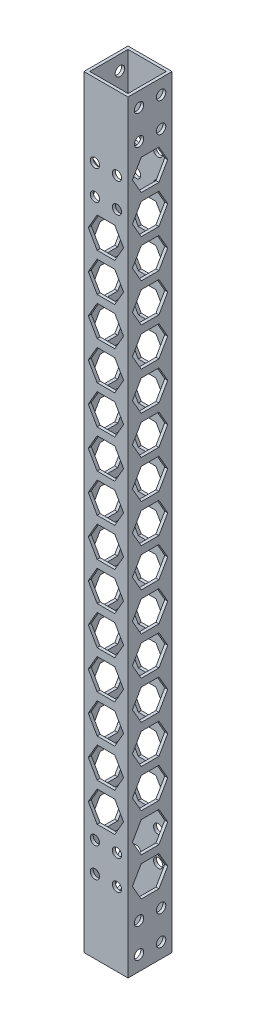
from build123d import *

# Parameters (mm, degrees)
SKETCH_1_W          = 15
SKETCH_1_H          = 15
SKETCH_1_W_2        = 13
SKETCH_1_H_2        = 13
EXTRUDE_1_DEPTH     = 259.4
CUT_EXTRUDE_1_REACH = 261.942
SKETCH_2_R          = 1.575
SKETCH_3_R          = 1.6
CUT_EXTRUDE_2_DEPTH = 15


with BuildPart() as part:
    # 草图1 → 凸台-拉伸1 (new body)
    with BuildSketch(Plane(origin=(0, 0, 0), x_dir=(1, 0, 0), z_dir=(0, 1, 0))):
        Rectangle(SKETCH_1_W, SKETCH_1_H)
        Rectangle(SKETCH_1_W_2, SKETCH_1_H_2, mode=Mode.SUBTRACT)
    extrude(amount=EXTRUDE_1_DEPTH)

    # 切除-拉伸1: up to this face of the body (flat: up to its plane)
    cut_extrude_1_end = Plane(part.part.faces().sort_by_distance((0, 129.7, -7.5))[0])
    # 草图2 → 切除-拉伸1 (cut, up to the picked face)
    with BuildSketch(Plane.XY.offset(7.5), mode=Mode.PRIVATE) as cut_extrude_1_sk1:
        with Locations((-3.75, 234.4)):
            Circle(SKETCH_2_R)
    cut_extrude_1_tool1 = split(extrude(cut_extrude_1_sk1.sketch, amount=-CUT_EXTRUDE_1_REACH, mode=Mode.PRIVATE), bisect_by=cut_extrude_1_end, keep=Keep.BOTH, mode=Mode.PRIVATE)
    # 草图2 → 切除-拉伸1 (cut, up to the picked face)
    with BuildSketch(Plane.XY.offset(7.5), mode=Mode.PRIVATE) as cut_extrude_1_sk2:
        with Locations((3.75, 234.4)):
            Circle(SKETCH_2_R)
    cut_extrude_1_tool2 = split(extrude(cut_extrude_1_sk2.sketch, amount=-CUT_EXTRUDE_1_REACH, mode=Mode.PRIVATE), bisect_by=cut_extrude_1_end, keep=Keep.BOTH, mode=Mode.PRIVATE)
    # 草图2 → 切除-拉伸1 (cut, up to the picked face)
    with BuildSketch(Plane.XY.offset(7.5), mode=Mode.PRIVATE) as cut_extrude_1_sk3:
        with Locations((-3.75, 224.4)):
            Circle(SKETCH_2_R)
    cut_extrude_1_tool3 = split(extrude(cut_extrude_1_sk3.sketch, amount=-CUT_EXTRUDE_1_REACH, mode=Mode.PRIVATE), bisect_by=cut_extrude_1_end, keep=Keep.BOTH, mode=Mode.PRIVATE)
    # 草图2 → 切除-拉伸1 (cut, up to the picked face)
    with BuildSketch(Plane.XY.offset(7.5), mode=Mode.PRIVATE) as cut_extrude_1_sk4:
        with Locations((3.75, 224.4)):
            Circle(SKETCH_2_R)
    cut_extrude_1_tool4 = split(extrude(cut_extrude_1_sk4.sketch, amount=-CUT_EXTRUDE_1_REACH, mode=Mode.PRIVATE), bisect_by=cut_extrude_1_end, keep=Keep.BOTH, mode=Mode.PRIVATE)
    # 草图2 → 切除-拉伸1 (cut, up to the picked face)
    with BuildSketch(Plane.XY.offset(7.5), mode=Mode.PRIVATE) as cut_extrude_1_sk5:
        with Locations((3.75, 35)):
            Circle(SKETCH_2_R)
    cut_extrude_1_tool5 = split(extrude(cut_extrude_1_sk5.sketch, amount=-CUT_EXTRUDE_1_REACH, mode=Mode.PRIVATE), bisect_by=cut_extrude_1_end, keep=Keep.BOTH, mode=Mode.PRIVATE)
    # 草图2 → 切除-拉伸1 (cut, up to the picked face)
    with BuildSketch(Plane.XY.offset(7.5), mode=Mode.PRIVATE) as cut_extrude_1_sk6:
        with Locations((-3.75, 35)):
            Circle(SKETCH_2_R)
    cut_extrude_1_tool6 = split(extrude(cut_extrude_1_sk6.sketch, amount=-CUT_EXTRUDE_1_REACH, mode=Mode.PRIVATE), bisect_by=cut_extrude_1_end, keep=Keep.BOTH, mode=Mode.PRIVATE)
    # 草图2 → 切除-拉伸1 (cut, up to the picked face)
    with BuildSketch(Plane.XY.offset(7.5), mode=Mode.PRIVATE) as cut_extrude_1_sk7:
        with Locations((3.75, 25)):
            Circle(SKETCH_2_R)
    cut_extrude_1_tool7 = split(extrude(cut_extrude_1_sk7.sketch, amount=-CUT_EXTRUDE_1_REACH, mode=Mode.PRIVATE), bisect_by=cut_extrude_1_end, keep=Keep.BOTH, mode=Mode.PRIVATE)
    # 草图2 → 切除-拉伸1 (cut, up to the picked face)
    with BuildSketch(Plane.XY.offset(7.5), mode=Mode.PRIVATE) as cut_extrude_1_sk8:
        with Locations((-3.75, 25)):
            Circle(SKETCH_2_R)
    cut_extrude_1_tool8 = split(extrude(cut_extrude_1_sk8.sketch, amount=-CUT_EXTRUDE_1_REACH, mode=Mode.PRIVATE), bisect_by=cut_extrude_1_end, keep=Keep.BOTH, mode=Mode.PRIVATE)
    # 草图2 → 切除-拉伸1 (cut, up to the picked face)
    with BuildSketch(Plane.XY.offset(7.5), mode=Mode.PRIVATE) as cut_extrude_1_sk9:
        Polygon((3, 206.4), (-3, 206.4), (-6, 201.203847577), (-3, 196.007695155), (3, 196.007695155), (6, 201.203847577), align=None)
    cut_extrude_1_tool9 = split(extrude(cut_extrude_1_sk9.sketch, amount=-CUT_EXTRUDE_1_REACH, mode=Mode.PRIVATE), bisect_by=cut_extrude_1_end, keep=Keep.BOTH, mode=Mode.PRIVATE)
    # 草图2 → 切除-拉伸1 (cut, up to the picked face)
    with BuildSketch(Plane.XY.offset(7.5), mode=Mode.PRIVATE) as cut_extrude_1_sk10:
        Polygon((-3, 219.4), (-6, 214.203847577), (-3, 209.007695155), (3, 209.007695155), (6, 214.203847577), (3, 219.4), align=None)
    cut_extrude_1_tool10 = split(extrude(cut_extrude_1_sk10.sketch, amount=-CUT_EXTRUDE_1_REACH, mode=Mode.PRIVATE), bisect_by=cut_extrude_1_end, keep=Keep.BOTH, mode=Mode.PRIVATE)
    # 草图2 → 切除-拉伸1 (cut, up to the picked face)
    with BuildSketch(Plane.XY.offset(7.5), mode=Mode.PRIVATE) as cut_extrude_1_sk11:
        Polygon((3, 193.4), (-3, 193.4), (-6, 188.203847577), (-3, 183.007695155), (3, 183.007695155), (6, 188.203847577), align=None)
    cut_extrude_1_tool11 = split(extrude(cut_extrude_1_sk11.sketch, amount=-CUT_EXTRUDE_1_REACH, mode=Mode.PRIVATE), bisect_by=cut_extrude_1_end, keep=Keep.BOTH, mode=Mode.PRIVATE)
    # 草图2 → 切除-拉伸1 (cut, up to the picked face)
    with BuildSketch(Plane.XY.offset(7.5), mode=Mode.PRIVATE) as cut_extrude_1_sk12:
        Polygon((3, 180.4), (-3, 180.4), (-6, 175.203847577), (-3, 170.007695155), (3, 170.007695155), (6, 175.203847577), align=None)
    cut_extrude_1_tool12 = split(extrude(cut_extrude_1_sk12.sketch, amount=-CUT_EXTRUDE_1_REACH, mode=Mode.PRIVATE), bisect_by=cut_extrude_1_end, keep=Keep.BOTH, mode=Mode.PRIVATE)
    # 草图2 → 切除-拉伸1 (cut, up to the picked face)
    with BuildSketch(Plane.XY.offset(7.5), mode=Mode.PRIVATE) as cut_extrude_1_sk13:
        Polygon((3, 167.4), (-3, 167.4), (-6, 162.203847577), (-3, 157.007695155), (3, 157.007695155), (6, 162.203847577), align=None)
    cut_extrude_1_tool13 = split(extrude(cut_extrude_1_sk13.sketch, amount=-CUT_EXTRUDE_1_REACH, mode=Mode.PRIVATE), bisect_by=cut_extrude_1_end, keep=Keep.BOTH, mode=Mode.PRIVATE)
    # 草图2 → 切除-拉伸1 (cut, up to the picked face)
    with BuildSketch(Plane.XY.offset(7.5), mode=Mode.PRIVATE) as cut_extrude_1_sk14:
        Polygon((3, 154.4), (-3, 154.4), (-6, 149.203847577), (-3, 144.007695155), (3, 144.007695155), (6, 149.203847577), align=None)
    cut_extrude_1_tool14 = split(extrude(cut_extrude_1_sk14.sketch, amount=-CUT_EXTRUDE_1_REACH, mode=Mode.PRIVATE), bisect_by=cut_extrude_1_end, keep=Keep.BOTH, mode=Mode.PRIVATE)
    # 草图2 → 切除-拉伸1 (cut, up to the picked face)
    with BuildSketch(Plane.XY.offset(7.5), mode=Mode.PRIVATE) as cut_extrude_1_sk15:
        Polygon((3, 141.4), (-3, 141.4), (-6, 136.203847577), (-3, 131.007695155), (3, 131.007695155), (6, 136.203847577), align=None)
    cut_extrude_1_tool15 = split(extrude(cut_extrude_1_sk15.sketch, amount=-CUT_EXTRUDE_1_REACH, mode=Mode.PRIVATE), bisect_by=cut_extrude_1_end, keep=Keep.BOTH, mode=Mode.PRIVATE)
    # 草图2 → 切除-拉伸1 (cut, up to the picked face)
    with BuildSketch(Plane.XY.offset(7.5), mode=Mode.PRIVATE) as cut_extrude_1_sk16:
        Polygon((3, 128.4), (-3, 128.4), (-6, 123.203847577), (-3, 118.007695155), (3, 118.007695155), (6, 123.203847577), align=None)
    cut_extrude_1_tool16 = split(extrude(cut_extrude_1_sk16.sketch, amount=-CUT_EXTRUDE_1_REACH, mode=Mode.PRIVATE), bisect_by=cut_extrude_1_end, keep=Keep.BOTH, mode=Mode.PRIVATE)
    # 草图2 → 切除-拉伸1 (cut, up to the picked face)
    with BuildSketch(Plane.XY.offset(7.5), mode=Mode.PRIVATE) as cut_extrude_1_sk17:
        Polygon((3, 115.4), (-3, 115.4), (-6, 110.203847577), (-3, 105.007695155), (3, 105.007695155), (6, 110.203847577), align=None)
    cut_extrude_1_tool17 = split(extrude(cut_extrude_1_sk17.sketch, amount=-CUT_EXTRUDE_1_REACH, mode=Mode.PRIVATE), bisect_by=cut_extrude_1_end, keep=Keep.BOTH, mode=Mode.PRIVATE)
    # 草图2 → 切除-拉伸1 (cut, up to the picked face)
    with BuildSketch(Plane.XY.offset(7.5), mode=Mode.PRIVATE) as cut_extrude_1_sk18:
        Polygon((3, 102.4), (-3, 102.4), (-6, 97.203847577), (-3, 92.007695155), (3, 92.007695155), (6, 97.203847577), align=None)
    cut_extrude_1_tool18 = split(extrude(cut_extrude_1_sk18.sketch, amount=-CUT_EXTRUDE_1_REACH, mode=Mode.PRIVATE), bisect_by=cut_extrude_1_end, keep=Keep.BOTH, mode=Mode.PRIVATE)
    # 草图2 → 切除-拉伸1 (cut, up to the picked face)
    with BuildSketch(Plane.XY.offset(7.5), mode=Mode.PRIVATE) as cut_extrude_1_sk19:
        Polygon((3, 89.4), (-3, 89.4), (-6, 84.203847577), (-3, 79.007695155), (3, 79.007695155), (6, 84.203847577), align=None)
    cut_extrude_1_tool19 = split(extrude(cut_extrude_1_sk19.sketch, amount=-CUT_EXTRUDE_1_REACH, mode=Mode.PRIVATE), bisect_by=cut_extrude_1_end, keep=Keep.BOTH, mode=Mode.PRIVATE)
    # 草图2 → 切除-拉伸1 (cut, up to the picked face)
    with BuildSketch(Plane.XY.offset(7.5), mode=Mode.PRIVATE) as cut_extrude_1_sk20:
        Polygon((3, 76.4), (-3, 76.4), (-6, 71.203847577), (-3, 66.007695155), (3, 66.007695155), (6, 71.203847577), align=None)
    cut_extrude_1_tool20 = split(extrude(cut_extrude_1_sk20.sketch, amount=-CUT_EXTRUDE_1_REACH, mode=Mode.PRIVATE), bisect_by=cut_extrude_1_end, keep=Keep.BOTH, mode=Mode.PRIVATE)
    # 草图2 → 切除-拉伸1 (cut, up to the picked face)
    with BuildSketch(Plane.XY.offset(7.5), mode=Mode.PRIVATE) as cut_extrude_1_sk21:
        Polygon((3, 63.4), (-3, 63.4), (-6, 58.203847577), (-3, 53.007695155), (3, 53.007695155), (6, 58.203847577), align=None)
    cut_extrude_1_tool21 = split(extrude(cut_extrude_1_sk21.sketch, amount=-CUT_EXTRUDE_1_REACH, mode=Mode.PRIVATE), bisect_by=cut_extrude_1_end, keep=Keep.BOTH, mode=Mode.PRIVATE)
    # 草图2 → 切除-拉伸1 (cut, up to the picked face)
    with BuildSketch(Plane.XY.offset(7.5), mode=Mode.PRIVATE) as cut_extrude_1_sk22:
        Polygon((3, 50.4), (-3, 50.4), (-6, 45.203847577), (-3, 40.007695155), (3, 40.007695155), (6, 45.203847577), align=None)
    cut_extrude_1_tool22 = split(extrude(cut_extrude_1_sk22.sketch, amount=-CUT_EXTRUDE_1_REACH, mode=Mode.PRIVATE), bisect_by=cut_extrude_1_end, keep=Keep.BOTH, mode=Mode.PRIVATE)
    add(cut_extrude_1_tool1.solids().sort_by(Axis((-3.75, 234.4, 7.5), (0, 0, -1)))[0], mode=Mode.SUBTRACT)
    add(cut_extrude_1_tool2.solids().sort_by(Axis((3.75, 234.4, 7.5), (0, 0, -1)))[0], mode=Mode.SUBTRACT)
    add(cut_extrude_1_tool3.solids().sort_by(Axis((-3.75, 224.4, 7.5), (0, 0, -1)))[0], mode=Mode.SUBTRACT)
    add(cut_extrude_1_tool4.solids().sort_by(Axis((3.75, 224.4, 7.5), (0, 0, -1)))[0], mode=Mode.SUBTRACT)
    add(cut_extrude_1_tool5.solids().sort_by(Axis((3.75, 35, 7.5), (0, 0, -1)))[0], mode=Mode.SUBTRACT)
    add(cut_extrude_1_tool6.solids().sort_by(Axis((-3.75, 35, 7.5), (0, 0, -1)))[0], mode=Mode.SUBTRACT)
    add(cut_extrude_1_tool7.solids().sort_by(Axis((3.75, 25, 7.5), (0, 0, -1)))[0], mode=Mode.SUBTRACT)
    add(cut_extrude_1_tool8.solids().sort_by(Axis((-3.75, 25, 7.5), (0, 0, -1)))[0], mode=Mode.SUBTRACT)
    add(cut_extrude_1_tool9.solids().sort_by(Axis((0, 201.203848, 7.5), (0, 0, -1)))[0], mode=Mode.SUBTRACT)
    add(cut_extrude_1_tool10.solids().sort_by(Axis((0, 214.203848, 7.5), (0, 0, -1)))[0], mode=Mode.SUBTRACT)
    add(cut_extrude_1_tool11.solids().sort_by(Axis((0, 188.203848, 7.5), (0, 0, -1)))[0], mode=Mode.SUBTRACT)
    add(cut_extrude_1_tool12.solids().sort_by(Axis((0, 175.203848, 7.5), (0, 0, -1)))[0], mode=Mode.SUBTRACT)
    add(cut_extrude_1_tool13.solids().sort_by(Axis((0, 162.203848, 7.5), (0, 0, -1)))[0], mode=Mode.SUBTRACT)
    add(cut_extrude_1_tool14.solids().sort_by(Axis((0, 149.203848, 7.5), (0, 0, -1)))[0], mode=Mode.SUBTRACT)
    add(cut_extrude_1_tool15.solids().sort_by(Axis((0, 136.203848, 7.5), (0, 0, -1)))[0], mode=Mode.SUBTRACT)
    add(cut_extrude_1_tool16.solids().sort_by(Axis((0, 123.203848, 7.5), (0, 0, -1)))[0], mode=Mode.SUBTRACT)
    add(cut_extrude_1_tool17.solids().sort_by(Axis((0, 110.203848, 7.5), (0, 0, -1)))[0], mode=Mode.SUBTRACT)
    add(cut_extrude_1_tool18.solids().sort_by(Axis((0, 97.203848, 7.5), (0, 0, -1)))[0], mode=Mode.SUBTRACT)
    add(cut_extrude_1_tool19.solids().sort_by(Axis((0, 84.203848, 7.5), (0, 0, -1)))[0], mode=Mode.SUBTRACT)
    add(cut_extrude_1_tool20.solids().sort_by(Axis((0, 71.203848, 7.5), (0, 0, -1)))[0], mode=Mode.SUBTRACT)
    add(cut_extrude_1_tool21.solids().sort_by(Axis((0, 58.203848, 7.5), (0, 0, -1)))[0], mode=Mode.SUBTRACT)
    add(cut_extrude_1_tool22.solids().sort_by(Axis((0, 45.203848, 7.5), (0, 0, -1)))[0], mode=Mode.SUBTRACT)

    # 草图3 → 切除-拉伸2 (cut)
    with BuildSketch(Plane.ZY.offset(7.5)):
        with Locations((-3.75, 254.4)):
            Circle(SKETCH_3_R)
        with Locations((3.75, 254.4)):
            Circle(SKETCH_3_R)
        with Locations((-3.75, 244.4)):
            Circle(SKETCH_3_R)
        with Locations((3.75, 244.4)):
            Circle(SKETCH_3_R)
        with Locations((3.75, 15)):
            Circle(SKETCH_3_R)
        with Locations((-3.75, 15)):
            Circle(SKETCH_3_R)
        with Locations((3.75, 5)):
            Circle(SKETCH_3_R)
        with Locations((-3.75, 5)):
            Circle(SKETCH_3_R)
        Polygon((3, 226.4), (-3, 226.4), (-6, 221.203847577), (-3, 216.007695155), (3, 216.007695155), (6, 221.203847577), align=None)
        Polygon((-3, 239.4), (-6, 234.203847577), (-3, 229.007695155), (3, 229.007695155), (6, 234.203847577), (3, 239.4), align=None)
        Polygon((3, 213.4), (-3, 213.4), (-6, 208.203847577), (-3, 203.007695155), (3, 203.007695155), (6, 208.203847577), align=None)
        Polygon((3, 200.4), (-3, 200.4), (-6, 195.203847577), (-3, 190.007695155), (3, 190.007695155), (6, 195.203847577), align=None)
        Polygon((3, 187.4), (-3, 187.4), (-6, 182.203847577), (-3, 177.007695155), (3, 177.007695155), (6, 182.203847577), align=None)
        Polygon((3, 174.4), (-3, 174.4), (-6, 169.203847577), (-3, 164.007695155), (3, 164.007695155), (6, 169.203847577), align=None)
        Polygon((3, 161.4), (-3, 161.4), (-6, 156.203847577), (-3, 151.007695155), (3, 151.007695155), (6, 156.203847577), align=None)
        Polygon((3, 148.4), (-3, 148.4), (-6, 143.203847577), (-3, 138.007695155), (3, 138.007695155), (6, 143.203847577), align=None)
        Polygon((3, 135.4), (-3, 135.4), (-6, 130.203847577), (-3, 125.007695155), (3, 125.007695155), (6, 130.203847577), align=None)
        Polygon((3, 122.4), (-3, 122.4), (-6, 117.203847577), (-3, 112.007695155), (3, 112.007695155), (6, 117.203847577), align=None)
        Polygon((3, 109.4), (-3, 109.4), (-6, 104.203847577), (-3, 99.007695155), (3, 99.007695155), (6, 104.203847577), align=None)
        Polygon((3, 96.4), (-3, 96.4), (-6, 91.203847577), (-3, 86.007695155), (3, 86.007695155), (6, 91.203847577), align=None)
        Polygon((3, 83.4), (-3, 83.4), (-6, 78.203847577), (-3, 73.007695155), (3, 73.007695155), (6, 78.203847577), align=None)
        Polygon((3, 70.4), (-3, 70.4), (-6, 65.203847577), (-3, 60.007695155), (3, 60.007695155), (6, 65.203847577), align=None)
        Polygon((3, 57.4), (-3, 57.4), (-6, 52.203847577), (-3, 47.007695155), (3, 47.007695155), (6, 52.203847577), align=None)
        Polygon((3, 44.4), (-3, 44.4), (-6, 39.203847577), (-3, 34.007695155), (3, 34.007695155), (6, 39.203847577), align=None)
        Polygon((3, 31.4), (-3, 31.4), (-6, 26.203847577), (-3, 21.007695155), (3, 21.007695155), (6, 26.203847577), align=None)
    extrude(amount=-CUT_EXTRUDE_2_DEPTH, mode=Mode.SUBTRACT)


solid = part.part
